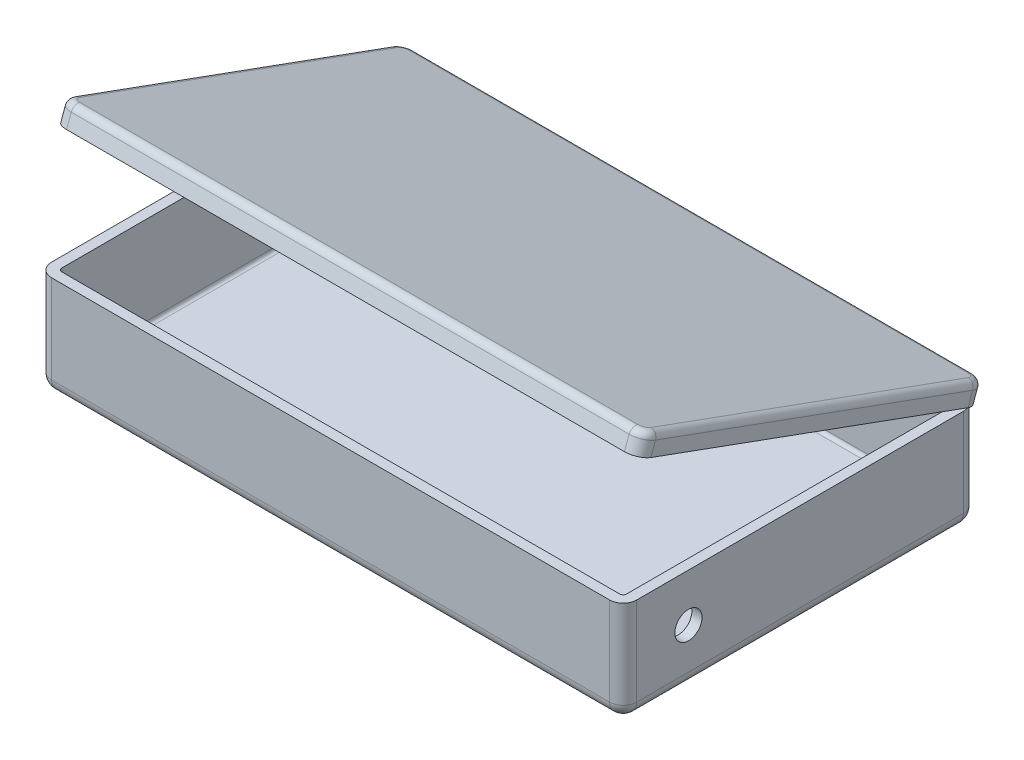
from build123d import *

# Parameters (mm, degrees)
SKETCH1_W                       = 273.05
SKETCH1_H                       = 165.1
BOSS_EXTRUDE1_DEPTH             = 47.625
FILLET1_R                       = 6.35
SHELL1_T                        = -4.7625
LID_OPENING_ANGLE_CONTROL_DEPTH = 136.525
FILLET2_R                       = 6.35
FILLET3_R                       = 3.175
SHELL2_T                        = -2.54
SKETCH3_R                       = 6.35
CUT_EXTRUDE1_DEPTH              = 4.7625


with BuildPart() as part:
    # Sketch1 → Boss-Extrude1 (new body)
    with BuildSketch(Plane(origin=(0, 0, 0), x_dir=(1, 0, 0), z_dir=(0, 1, 0))):
        Rectangle(SKETCH1_W, SKETCH1_H)
    extrude(amount=BOSS_EXTRUDE1_DEPTH)

    # Fillet1
    fillet1_edges = [part.edges().sort_by_distance(p)[0] for p in [
        (0, 0, 82.55),
        (-136.525, 0, 0),
        (0, 0, -82.55),
        (136.525, 0, 0),
        (136.525, 23.8125, 82.55),
        (-136.525, 23.8125, 82.55),
        (-136.525, 23.8125, -82.55),
        (136.525, 23.8125, -82.55),
    ]]
    fillet(fillet1_edges, radius=FILLET1_R)

    # Shell1
    shell1_openings = [part.faces().sort_by_distance(p)[0] for p in [
        (0, 47.625, 0),
    ]]
    offset(amount=SHELL1_T, openings=shell1_openings, kind=Kind.INTERSECTION)

    # Sketch3 → Cut-Extrude1 (cut)
    with BuildSketch(Plane(origin=(136.525, 0, 0), x_dir=(0, 0, -1), z_dir=(1, 0, 0))):
        with Locations((-52.07, 25.4)):
            Circle(SKETCH3_R)
    extrude(amount=-CUT_EXTRUDE1_DEPTH, mode=Mode.SUBTRACT)


with BuildPart() as body_2:
    # Sketch2 → LID OPENING ANGLE CONTROL (new, symmetric)
    with BuildSketch(Plane(origin=(0, 0, 0), x_dir=(0, 0, -1), z_dir=(1, 0, 0))):
        Polygon((84.346051224, 45.828948776), (-75.570838981, 104.033936767), (-72.313097116, 112.98450898), (87.603793089, 54.779520989), align=None)
    extrude(amount=LID_OPENING_ANGLE_CONTROL_DEPTH, both=True)

    # Fillet2
    fillet2_edges = [body_2.edges().sort_by_distance(p)[0] for p in [
        (136.525, 108.509222873, 73.941968049),
        (136.525, 50.304234882, -85.974922157),
        (-136.525, 108.509222873, 73.941968049),
        (-136.525, 50.304234882, -85.974922157),
    ]]
    fillet(fillet2_edges, radius=FILLET2_R)

    # Fillet3
    fillet3_edges = [body_2.edges().sort_by_distance(p)[0] for p in [
        (136.525, 83.882014984, -7.645347987),
        (-136.525, 83.882014984, -7.645347987),
        (0, 112.98450898, 72.313097116),
        (0, 54.779520989, -87.603793089),
        (-134.665128061, 112.348395313, 70.565389179),
        (134.665128061, 112.348395313, 70.565389179),
        (-134.665128061, 55.415634656, -85.856085152),
        (134.665128061, 55.415634656, -85.856085152),
    ]]
    fillet(fillet3_edges, radius=FILLET3_R)

    # Shell2
    shell2_openings = [body_2.faces().sort_by_distance(p)[0] for p in [
        (0, 74.931442771, -4.387606122),
    ]]
    offset(amount=SHELL2_T, openings=shell2_openings, kind=Kind.INTERSECTION)


solid = Compound([part.part, body_2.part])
